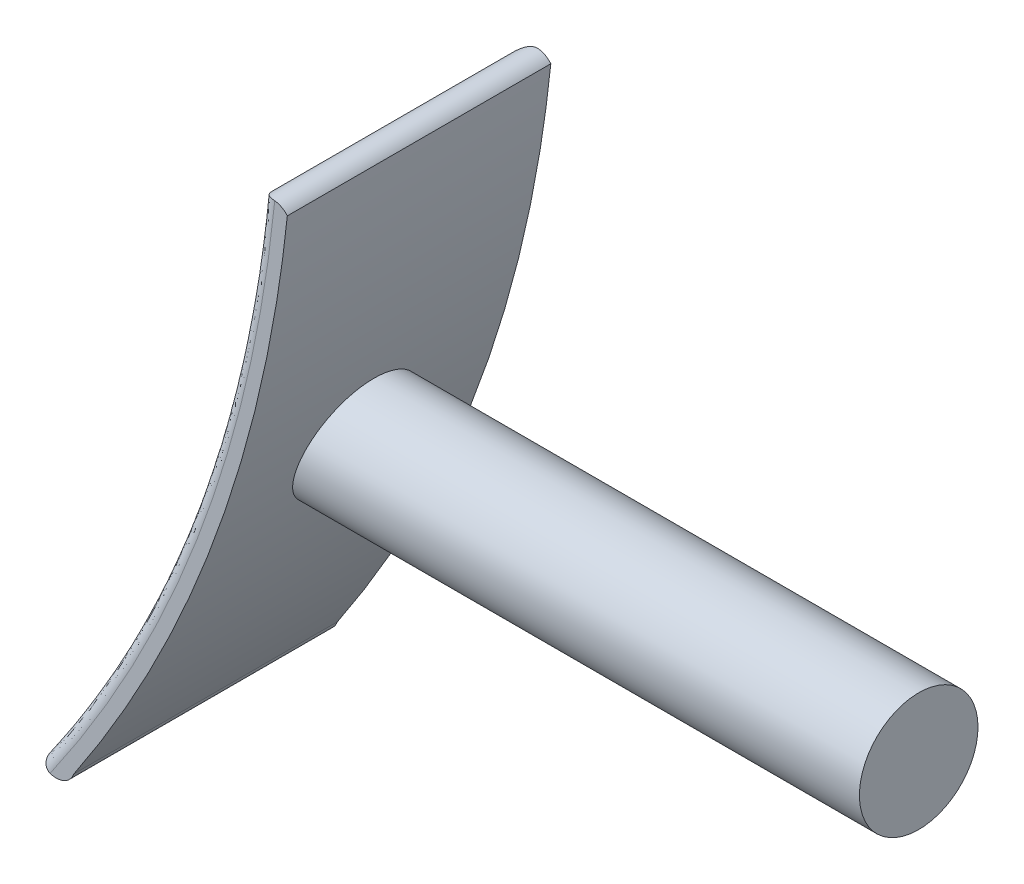
from build123d import *

# Parameters (mm, degrees)
BOSS_EXTRUDE1_DEPTH             = 25.4
SKETCH2_R                       = 5.715
BOSS_EXTRUDE2_DEPTH             = 48.26
BOSS_EXTRUDE2_DIRECTION_2_REACH = 52.818
FILLET1_R                       = 1.27


with BuildPart() as part:
    # Sketch1 → Boss-Extrude1 (new body)
    with BuildSketch(Plane.XY):
        with BuildLine():
            ThreePointArc((-21.315601844, -20.824385658), (-19.601712639, -21.737702654), (-18.056418846, -20.5614241))
            add(Edge.make_bspline(
                [(2.526351365, 36.325614342), (-0.715696382, 5.186662468), (-18.056418846, -20.5614241)],
                knots=[0, 0, 0, 0.967613504, 0.967613504, 0.967613504], degree=2))
            ThreePointArc((2.526351365, 36.325614342), (1.317636804, 36.98031962), (0, 36.5885759))
            add(Edge.make_bspline(
                [(0, 36.5885759), (-3.282504286, 5.052562618), (-21.315601844, -20.824385658)],
                knots=[0, 0, 0, 1, 1, 1], degree=2))
        make_face()
    extrude(amount=BOSS_EXTRUDE1_DEPTH)

    # Sketch2 → Boss-Extrude2 (add)
    with BuildSketch(Plane(origin=(2.54, 0, 0), x_dir=(0, 0, -1), z_dir=(1, 0, 0))):
        with Locations((-12.812340203, 8.6485759)):
            Circle(SKETCH2_R)
    extrude(amount=BOSS_EXTRUDE2_DEPTH)

    # Sketch2 → Boss-Extrude2 direction 2 (add, up to next)
    with BuildSketch(Plane(origin=(2.54, 0, 0), x_dir=(0, 0, -1), z_dir=(1, 0, 0)), mode=Mode.PRIVATE) as boss_extrude2_direction_2_sk1:
        with Locations((-12.812340203, 8.6485759)):
            Circle(SKETCH2_R)
    boss_extrude2_direction_2_tool1 = extrude(boss_extrude2_direction_2_sk1.sketch, amount=-BOSS_EXTRUDE2_DIRECTION_2_REACH, mode=Mode.PRIVATE) - part.part
    add(boss_extrude2_direction_2_tool1.solids().sort_by_distance((2.54, 8.648576, 12.81234))[0])

    # Fillet1
    fillet1_edges = [part.edges().sort_by_distance(p)[0] for p in [
        (-6.955501037, 6.506813911, 25.4),
        (-6.955501037, 6.506813911, 0),
    ]]
    fillet(fillet1_edges, radius=FILLET1_R)


solid = part.part
